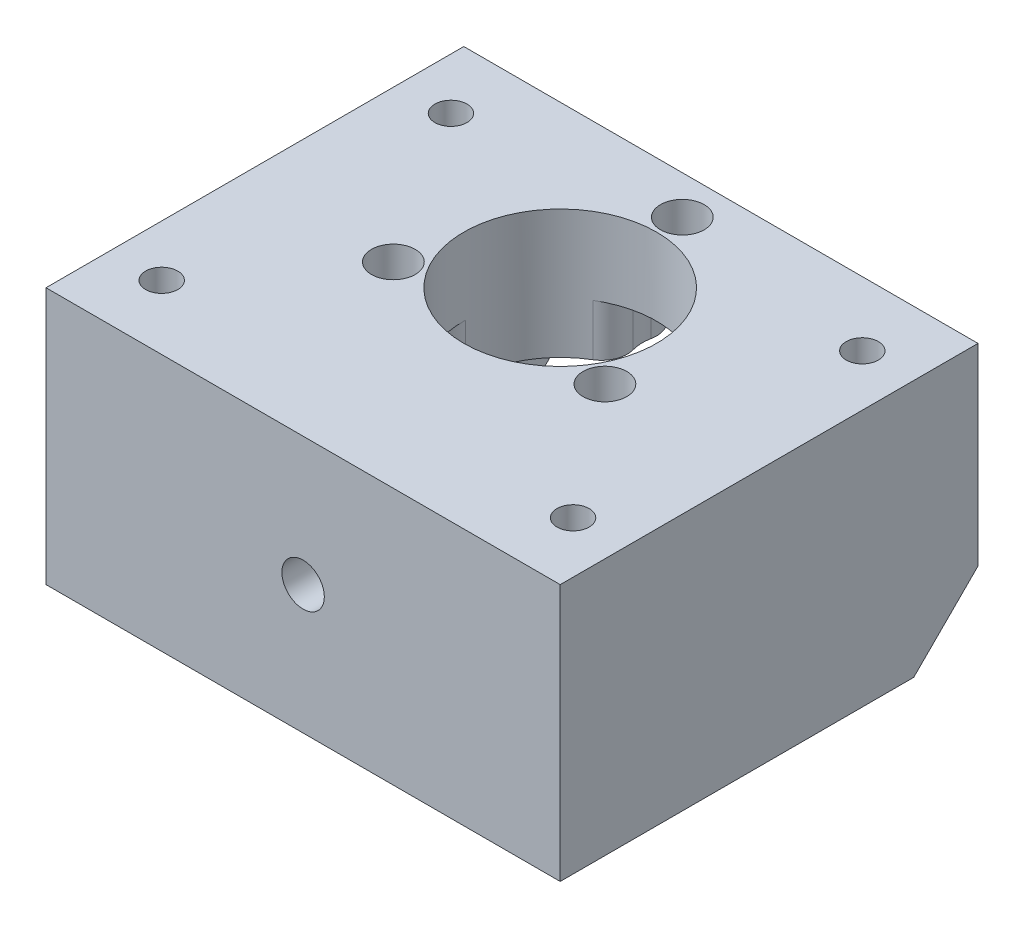
from build123d import *

# Parameters (mm, degrees)
SKETCH3_W                                            = 40
SKETCH3_H                                            = 25
BOSS_EXTRUDE2_DEPTH                                  = 5
CUT_EXTRUDE2_DEPTH                                   = 26.617376915
CUT_EXTRUDE2_DEPTH_BACK                              = 26.617376915
SKETCH4_R                                            = 7.5
SKETCH5_W                                            = 40
SKETCH5_H                                            = 10
BOSS_EXTRUDE3_DEPTH                                  = 20
CBORE_FOR_M3_HEXAGON_SOCKET_HEAD_CAP_SCR_D           = 3.4
CBORE_FOR_M3_HEXAGON_SOCKET_HEAD_CAP_SCR_CBORE_D     = 6.2
CBORE_FOR_M3_HEXAGON_SOCKET_HEAD_CAP_SCR_CBORE_DEPTH = 4
FILLET1_R                                            = 2
SKETCH9_W                                            = 22.5
SKETCH9_H                                            = 10
BOSS_EXTRUDE4_DEPTH                                  = 8
CHAMFER1_SIZE                                        = 5
M3_TAPPED_HOLE1_D                                    = 2.5
M3_TAPPED_HOLE1_DEPTH                                = 10
M3_TAPPED_HOLE1_TIP                                  = 0.751075774
FILLET2_R                                            = 3
M4_TAPPED_HOLE1_D                                    = 3.3
M4_TAPPED_HOLE1_DEPTH                                = 8
M4_TAPPED_HOLE1_TIP                                  = 0.991420021


with BuildPart() as part:
    # Sketch3 → Boss-Extrude2 (new, symmetric)
    with BuildSketch(Plane(origin=(0, 0, 0), x_dir=(1, 0, 0), z_dir=(0, 1, 0))):
        Rectangle(SKETCH3_W, SKETCH3_H)
    extrude(amount=BOSS_EXTRUDE2_DEPTH, both=True)

    # Sketch4 → Cut-Extrude2 (cut, two sides: drawn at the far end of the back side and taken through both)
    with BuildSketch(Plane(origin=(0, 5, 0), x_dir=(1, 0, 0), z_dir=(0, 1, 0)).offset(-CUT_EXTRUDE2_DEPTH_BACK)):
        with Locations(Location((0, 0, 0), (0, 0, 270))):
            Circle(SKETCH4_R)
    extrude(amount=CUT_EXTRUDE2_DEPTH + CUT_EXTRUDE2_DEPTH_BACK, mode=Mode.SUBTRACT)

    # Sketch5 → Boss-Extrude3 (add)
    with BuildSketch(Plane.XZ.offset(-5)):
        with Locations((0, 15)):
            Rectangle(SKETCH5_W, SKETCH5_H)
    extrude(amount=BOSS_EXTRUDE3_DEPTH)

    # CBORE for M3 Hexagon socket head cap screws1 (through all)
    with Locations(Plane(origin=(0, -5, 0), x_dir=(-1, 0, 0), z_dir=(0, -1, 0))):
        with Locations((0, 9.5), (8.227241336, -4.75), (-8.227241336, -4.75)):
            CounterBoreHole(CBORE_FOR_M3_HEXAGON_SOCKET_HEAD_CAP_SCR_D / 2, CBORE_FOR_M3_HEXAGON_SOCKET_HEAD_CAP_SCR_CBORE_D / 2, CBORE_FOR_M3_HEXAGON_SOCKET_HEAD_CAP_SCR_CBORE_DEPTH)

    # Fillet1
    fillet1_edges = [part.edges().sort_by_distance(p)[0] for p in [
        (5.197639771, -3, 5.406897522),
        (7.281330495, -3, 1.79783932),
        (-7.281330495, -3, 1.79783932),
        (-5.197639771, -3, 5.406897522),
        (2.083690725, -3, -7.204736842),
        (-2.083690725, -3, -7.204736842),
        (-0.781024968, -3, -12.5),
        (0.781024968, -3, -12.5),
    ]]
    fillet(fillet1_edges, radius=FILLET1_R)

    # Sketch9 → Boss-Extrude4 (add)
    with BuildSketch(Plane(origin=(20, 0, 0), x_dir=(0, 0, -1), z_dir=(1, 0, 0))):
        with Locations((1.25, -10)):
            Rectangle(SKETCH9_W, SKETCH9_H)
    boss_extrude4 = extrude(amount=-BOSS_EXTRUDE4_DEPTH)

    # Mirror1: Boss-Extrude4 across plane
    add(boss_extrude4.mirror(Plane(origin=(0, 0, 0), x_dir=(0, 0, 1), z_dir=(1, 0, 0))))

    # Chamfer1
    chamfer1_edges = [part.edges().sort_by_distance(p)[0] for p in [
        (16, -15, -12.5),
        (-16, -15, -12.5),
    ]]
    chamfer(chamfer1_edges, length=CHAMFER1_SIZE)

    # M3 Tapped Hole1
    with Locations(Plane(origin=(0, 5, 0), x_dir=(1, 0, 0), z_dir=(0, 1, 0))):
        with Locations((-16, 7.5), (-16, -15), (16, -15), (16, 7.5)):
            Hole(M3_TAPPED_HOLE1_D / 2, depth=M3_TAPPED_HOLE1_DEPTH)
            with Locations((0, 0, -(M3_TAPPED_HOLE1_DEPTH + M3_TAPPED_HOLE1_TIP / 2))):  # 118° drill point
                Cone(0, M3_TAPPED_HOLE1_D / 2, M3_TAPPED_HOLE1_TIP, mode=Mode.SUBTRACT)

    # Fillet2
    fillet2_edges = [part.edges().sort_by_distance(p)[0] for p in [
        (12, -10, 10),
        (-12, -10, 10),
    ]]
    fillet(fillet2_edges, radius=FILLET2_R)

    # M4 Tapped Hole1
    with Locations(Plane.XY.offset(20)):
        with Locations((0, -5)):
            Hole(M4_TAPPED_HOLE1_D / 2, depth=M4_TAPPED_HOLE1_DEPTH)
            with Locations((0, 0, -(M4_TAPPED_HOLE1_DEPTH + M4_TAPPED_HOLE1_TIP / 2))):  # 118° drill point
                Cone(0, M4_TAPPED_HOLE1_D / 2, M4_TAPPED_HOLE1_TIP, mode=Mode.SUBTRACT)


solid = part.part
